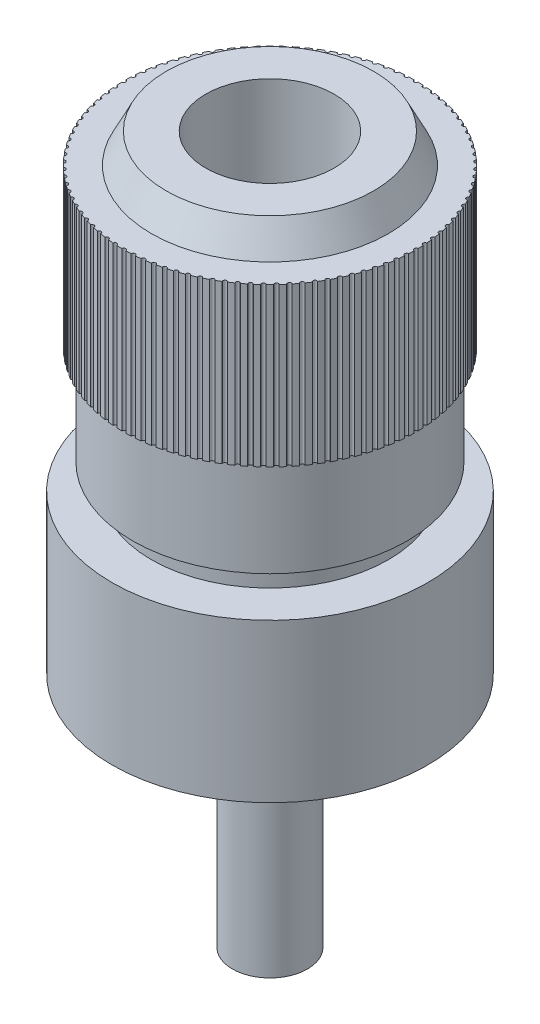
from build123d import *

# Parameters (mm, degrees)
CROQUIS1_R              = 6
CROQUIS1_R_2            = 2.25
SALIENTE_EXTRUIR1_DEPTH = 0.7
CROQUIS3_R              = 8
CROQUIS3_R_2            = 2.25
SALIENTE_EXTRUIR2_DEPTH = 8
CROQUIS6_R              = 1.9
SALIENTE_EXTRUIR3_DEPTH = 20
CROQUIS7_R              = 6
SALIENTE_EXTRUIR4_DEPTH = 1.3
CROQUIS8_R              = 2.8
CROQUIS8_R_2            = 1.75
SALIENTE_EXTRUIR5_DEPTH = 10
CROQUIS9_R              = 7.4
CROQUIS9_R_2            = 3.25
SALIENTE_EXTRUIR6_DEPTH = 14.5
CROQUIS11_W             = 0.45
CROQUIS11_H             = 5
CORTAR_EXTRUIR1_DEPTH   = 9.5
MATRIZC1_COUNT          = 100


with BuildPart() as part:
    # Croquis1 → Saliente-Extruir1 (new body)
    with BuildSketch(Plane(origin=(0, 0, 0), x_dir=(1, 0, 0), z_dir=(0, 1, 0))):
        with Locations(Location((0, 0, 0), (0, 0, 270))):
            Circle(CROQUIS1_R)
        with Locations(Location((0, 0, 0), (0, 0, 270))):
            Circle(CROQUIS1_R_2, mode=Mode.SUBTRACT)
    extrude(amount=SALIENTE_EXTRUIR1_DEPTH)

    # Croquis3 → Saliente-Extruir2 (add)
    with BuildSketch(Plane(origin=(0, 0.7, 0), x_dir=(1, 0, 0), z_dir=(0, 1, 0))):
        with Locations(Location((0, 0, 0), (0, 0, 270))):
            Circle(CROQUIS3_R)
        with Locations(Location((0, 0, 0), (0, 0, 270))):
            Circle(CROQUIS3_R_2, mode=Mode.SUBTRACT)
    extrude(amount=SALIENTE_EXTRUIR2_DEPTH)



with BuildPart() as body_2:
    # Croquis6 → Saliente-Extruir3 (new body)
    with BuildSketch(Plane(origin=(0, 8.7, 0), x_dir=(1, 0, 0), z_dir=(0, 1, 0))):
        with Locations(Location((0, 0, 0), (0, 0, 270))):
            Circle(CROQUIS6_R)
    extrude(amount=-SALIENTE_EXTRUIR3_DEPTH)


with BuildPart() as part_1:
    add(part.part)

    add(body_2.part)  # Saliente-Extruir4 merges body 2
    # Croquis7 → Saliente-Extruir4 (add)
    with BuildSketch(Plane(origin=(0, 8.7, 0), x_dir=(1, 0, 0), z_dir=(0, 1, 0))):
        with Locations(Location((0, 0, 0), (0, 0, 270))):
            Circle(CROQUIS7_R)
    extrude(amount=SALIENTE_EXTRUIR4_DEPTH)

    # Croquis8 → Saliente-Extruir5 (add)
    with BuildSketch(Plane(origin=(0, 10, 0), x_dir=(1, 0, 0), z_dir=(0, 1, 0))):
        with Locations(Location((0, 0, 0), (0, 0, 270))):
            Circle(CROQUIS8_R)
        with Locations(Location((0, 0, 0), (0, 0, 270))):
            Circle(CROQUIS8_R_2, mode=Mode.SUBTRACT)
    extrude(amount=SALIENTE_EXTRUIR5_DEPTH)

    # Croquis9 → Saliente-Extruir6 (add)
    with BuildSketch(Plane(origin=(0, 10, 0), x_dir=(1, 0, 0), z_dir=(0, 1, 0))):
        with Locations(Location((0, 0, 0), (0, 0, 90))):
            Circle(CROQUIS9_R)
        with Locations(Location((0, 0, 0), (0, 0, 90))):
            Circle(CROQUIS9_R_2, mode=Mode.SUBTRACT)
    extrude(amount=SALIENTE_EXTRUIR6_DEPTH)

    # Croquis11 → Cortar-Revolución1 (revolve, cut)
    with BuildSketch(Plane.XY, mode=Mode.PRIVATE) as cortar_revoluci_n1_sk:
        Polygon((-7.4, 24.5), (-5.25, 24.5), (-6, 23), (-7.4, 23), align=None)
        with Locations((-7.175, 12.5)):
            Rectangle(CROQUIS11_W, CROQUIS11_H)
    revolve(cortar_revoluci_n1_sk.sketch.rotate(Axis((0, 0, 0), (0, 1, 0)), 270), axis=Axis((0, 0, 0), (0, 1, 0)), mode=Mode.SUBTRACT)

    # Croquis12 → Cortar-Extruir1 (cut)
    with BuildSketch(Plane(origin=(0, 23, 0), x_dir=(1, 0, 0), z_dir=(0, 1, 0))):
        with BuildLine():
            Line((0.402696208, -52.197678267), (0.099997717, -7.399324324))
            ThreePointArc((0.099997717, -7.399324324), (0, -7.3), (-0.099997717, -7.399324324))
            Line((-0.099997717, -7.399324324), (-0.402696208, -52.197678267))
            Line((-0.402696208, -52.197678267), (-0.402696208, -141.796431436))
            Line((-0.402696208, -141.796431436), (0.402696208, -141.796431436))
            Line((0.402696208, -141.796431436), (0.402696208, -52.197678267))
        make_face()
    cortar_extruir1 = extrude(amount=-CORTAR_EXTRUIR1_DEPTH, mode=Mode.SUBTRACT)

    # MatrizC1: Cortar-Extruir1 ×100 about axis
    matrizc1_axis = Axis((0, 0, 0), (0, 1, 0))
    for i in range(1, MATRIZC1_COUNT):
        add(cortar_extruir1.rotate(matrizc1_axis, i * 360 / MATRIZC1_COUNT), mode=Mode.SUBTRACT)


solid = part_1.part
